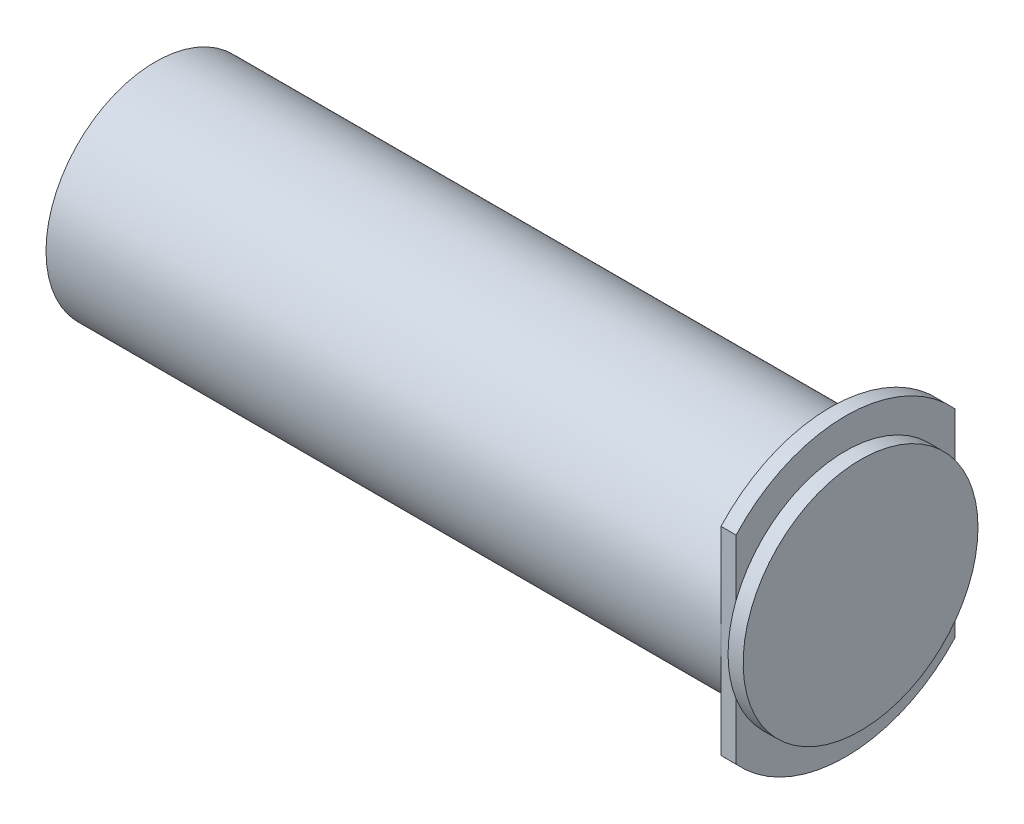
from build123d import *

# Parameters (mm, degrees)
CUT_EXTRUDE1_DEPTH      = 45
CUT_EXTRUDE1_DEPTH_BACK = 260
SKETCH2_R               = 3.825
SKETCH3_R               = 23.31
CUT_EXTRUDE2_DEPTH      = 149
SKETCH4_R               = 24.31
SKETCH4_R_2             = 23.31
BOSS_EXTRUDE1_DEPTH     = 3.35
SKETCH6_R               = 26.095
BOSS_EXTRUDE7_DEPTH     = 3.35


with BuildPart() as part:
    # Sketch1 → Revolve2 (revolve)
    with BuildSketch(Plane.XY, mode=Mode.PRIVATE) as revolve2_sk:
        Polygon((-73.894736842, 0), (76.105263158, 0), (76.105263158, 24.31), (-73.894736842, 24.31), (-73.894736842, 4.825), (-78.894736842, 4.825), (-78.894736842, 0), align=None)
    revolve(revolve2_sk.sketch.rotate(Axis((-73.894736842, 0, 0), (1, 0, 0)), 90), axis=Axis((-73.894736842, 0, 0), (1, 0, 0)))

    # Sketch2 → Cut-Extrude1 (cut, two sides: drawn at the far end of the back side and taken through both)
    with BuildSketch(Plane.ZY.offset(78.894736842).offset(-CUT_EXTRUDE1_DEPTH_BACK)):
        with Locations(Location((0, 0, 0), (0, 0, 180))):
            Circle(SKETCH2_R)
    extrude(amount=CUT_EXTRUDE1_DEPTH + CUT_EXTRUDE1_DEPTH_BACK, mode=Mode.SUBTRACT)

    # Sketch3 → Cut-Extrude2 (cut)
    with BuildSketch(Plane(origin=(76.105263158, 0, 0), x_dir=(0, 0, -1), z_dir=(1, 0, 0))):
        Circle(SKETCH3_R)
    extrude(amount=-CUT_EXTRUDE2_DEPTH, mode=Mode.SUBTRACT)


with BuildPart() as body_2:
    # Sketch4 → Boss-Extrude1 (new body)
    # profile 1 of 4: a face of its own
    with BuildSketch(Plane(origin=(76.105263158, 0, 0), x_dir=(0, 0, -1), z_dir=(1, 0, 0))):
        with BuildLine():
            ThreePointArc((-24.31, 0), (0, 24.31), (24.31, 0))
            Line((24.31, 0), (24.31, 22.049405888))
            ThreePointArc((24.31, 22.049405888), (0, 32.82), (-24.31, 22.049405888))
            Line((-24.31, 22.049405888), (-24.31, 0))
        make_face()
    # profile 2 of 4: a face of its own
    with BuildSketch(Plane(origin=(76.105263158, 0, 0), x_dir=(0, 0, -1), z_dir=(1, 0, 0))):
        with BuildLine():
            ThreePointArc((-24.31, 0), (0, 24.31), (24.31, 0))
            Line((24.31, 0), (24.31, 22.049405888))
            ThreePointArc((24.31, 22.049405888), (0, 32.82), (-24.31, 22.049405888))
            Line((-24.31, 22.049405888), (-24.31, 0))
        make_face()
    # profile 3 of 4: a face of its own
    with BuildSketch(Plane(origin=(76.105263158, 0, 0), x_dir=(0, 0, -1), z_dir=(1, 0, 0))):
        with BuildLine():
            Line((24.31, -22.049405888), (24.31, 0))
            ThreePointArc((24.31, 0), (0, -24.31), (-24.31, 0))
            Line((-24.31, 0), (-24.31, -22.049405888))
            ThreePointArc((-24.31, -22.049405888), (0, -32.82), (24.31, -22.049405888))
        make_face()
    # profile 4 of 4: a face of its own
    with BuildSketch(Plane(origin=(76.105263158, 0, 0), x_dir=(0, 0, -1), z_dir=(1, 0, 0))):
        with Locations(Location((0, 0, 0), (0, 0, 180))):
            Circle(SKETCH4_R)
        Circle(SKETCH4_R_2, mode=Mode.SUBTRACT)
    extrude(amount=BOSS_EXTRUDE1_DEPTH)

    # Sketch6 → Boss-Extrude7 (add)
    with BuildSketch(Plane(origin=(79.455263158, 0, 0), x_dir=(0, 0, -1), z_dir=(1, 0, 0))):
        with Locations(Location((0, 0, 0), (0, 0, 158.684999133))):
            Circle(SKETCH6_R)
    extrude(amount=BOSS_EXTRUDE7_DEPTH)


solid = Compound([part.part, body_2.part])
